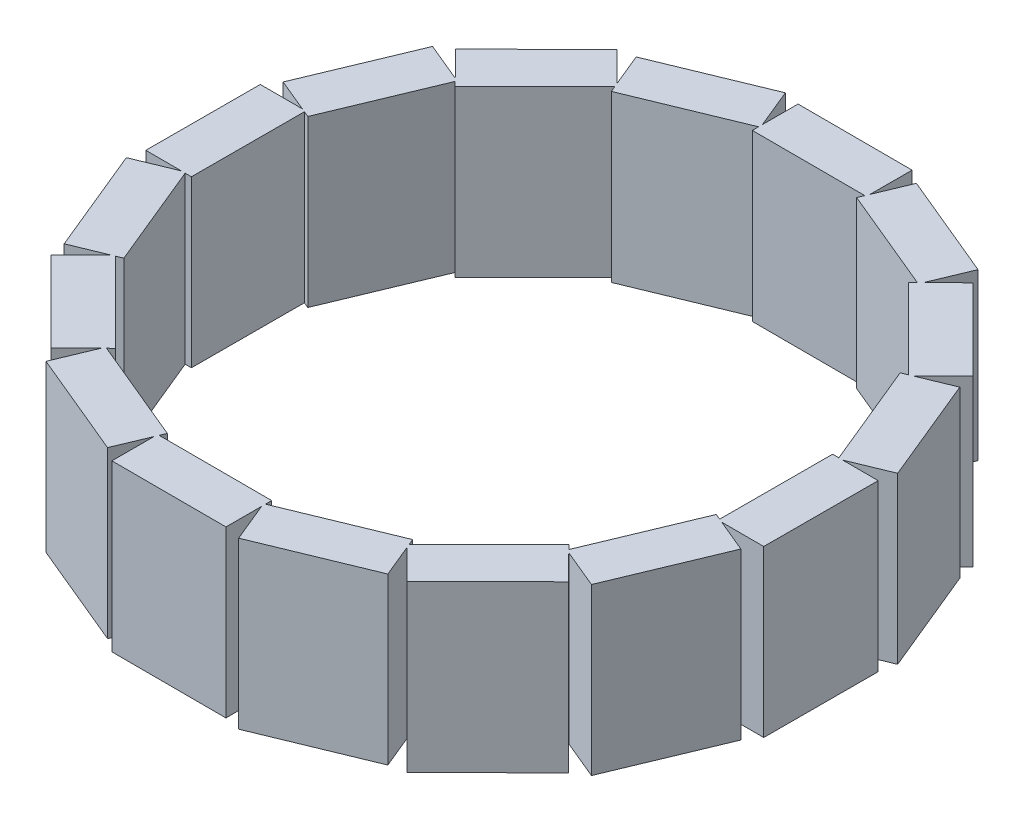
from build123d import *

# Parameters (mm, degrees)
SKETCH1_R           = 140.65
BOSS_EXTRUDE1_DEPTH = 12.7
BOSS_EXTRUDE2_DEPTH = 72.4
CIRPATTERN1_COUNT   = 16
SKETCH4_R           = 140.65
CUT_EXTRUDE1_DEPTH  = 12.7


with BuildPart() as part:
    # Sketch1 → Boss-Extrude1 (new body)
    with BuildSketch(Plane(origin=(0, 0, 0), x_dir=(1, 0, 0), z_dir=(0, 1, 0))):
        with Locations(Location((0, 0, 0), (0, 0, 270))):
            Circle(SKETCH1_R)
    extrude(amount=BOSS_EXTRUDE1_DEPTH)

    # Sketch3 → Boss-Extrude2 (add)
    with BuildSketch(Plane(origin=(0, 12.7, 0), x_dir=(1, 0, 0), z_dir=(0, 1, 0))):
        Polygon((-62.512510333, 104.73288314), (-16.28303914, 123.781137474), (-23.902340873, 142.272925951), (-70.131812067, 123.224671617), align=None)
    boss_extrude2 = extrude(amount=BOSS_EXTRUDE2_DEPTH)

    # CirPattern1: Boss-Extrude2 ×16 about axis
    cirpattern1_axis = Axis((0.678796416, 0, 1.91510031), (0, 1, 0))
    for i in range(1, CIRPATTERN1_COUNT):
        add(boss_extrude2.rotate(cirpattern1_axis, i * 360 / CIRPATTERN1_COUNT))

    # Sketch4 → Cut-Extrude1 (cut)
    with BuildSketch(Plane.XZ):
        Circle(SKETCH4_R)
    extrude(amount=-CUT_EXTRUDE1_DEPTH, mode=Mode.SUBTRACT)


solid = part.part
